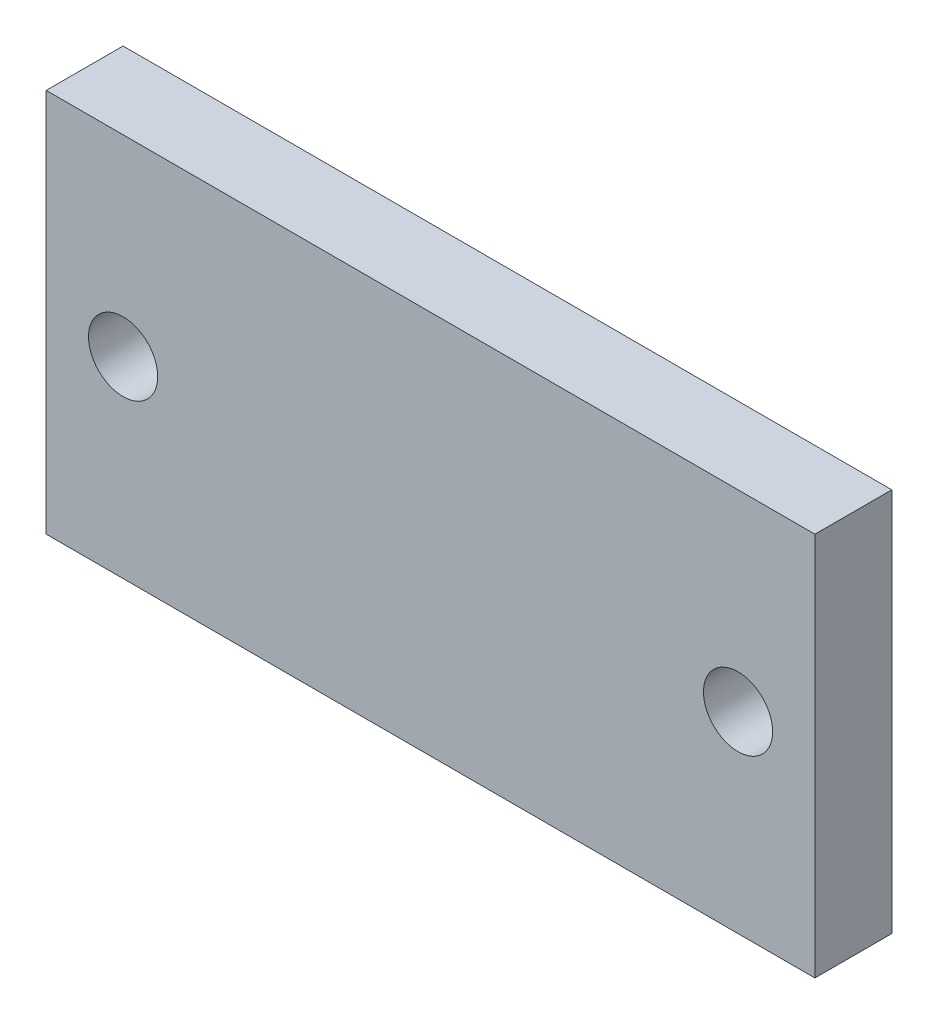
from build123d import *

# Parameters (mm, degrees)
SKETCH1_W            = 50
SKETCH1_H            = 25
BOSS_EXTRUDE1_DEPTH  = 5
M4_CLEARANCE_HOLE1_D = 4.5


with BuildPart() as part:
    # Sketch1 → Boss-Extrude1 (new body)
    with BuildSketch(Plane.XY):
        with Locations((25, 12.5)):
            Rectangle(SKETCH1_W, SKETCH1_H)
    extrude(amount=BOSS_EXTRUDE1_DEPTH)

    # M4 Clearance Hole1 (through all)
    with Locations(Plane.XY.offset(5)):
        with Locations((5, 12.5), (45, 12.5)):
            Hole(M4_CLEARANCE_HOLE1_D / 2)


solid = part.part
